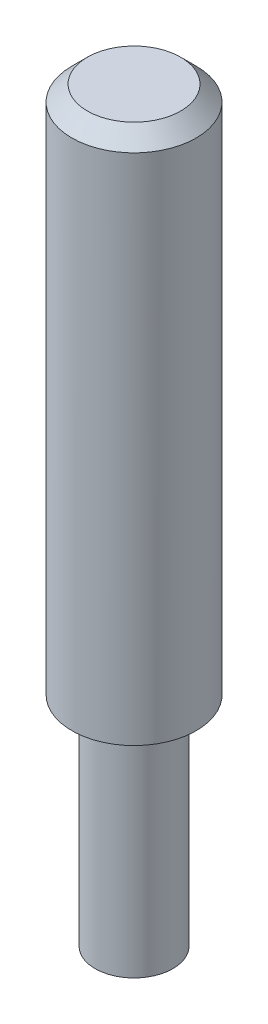
from build123d import *

# Parameters (mm, degrees)
SKETCH1_R           = 4
BOSS_EXTRUDE1_DEPTH = 48
SKETCH2_R           = 4
SKETCH2_R_2         = 2.5
CUT_EXTRUDE1_DEPTH  = 14
CHAMFER1_SIZE       = 1


with BuildPart() as part:
    # Sketch1 → Boss-Extrude1 (new body)
    with BuildSketch(Plane(origin=(0, 0, 0), x_dir=(1, 0, 0), z_dir=(0, 1, 0))):
        with Locations(Location((0, 0, 0), (0, 0, 270))):
            Circle(SKETCH1_R)
    extrude(amount=BOSS_EXTRUDE1_DEPTH)

    # Sketch2 → Cut-Extrude1 (cut)
    with BuildSketch(Plane.XZ):
        with Locations(Location((0, 0, 0), (0, 0, 270))):
            Circle(SKETCH2_R)
        with Locations(Location((0, 0, 0), (0, 0, 270))):
            Circle(SKETCH2_R_2, mode=Mode.SUBTRACT)
    extrude(amount=-CUT_EXTRUDE1_DEPTH, mode=Mode.SUBTRACT)

    # Chamfer1
    chamfer1_edges = [part.edges().sort_by_distance(p)[0] for p in [
        (0, 48, -4),
    ]]
    chamfer(chamfer1_edges, length=CHAMFER1_SIZE)


solid = part.part
